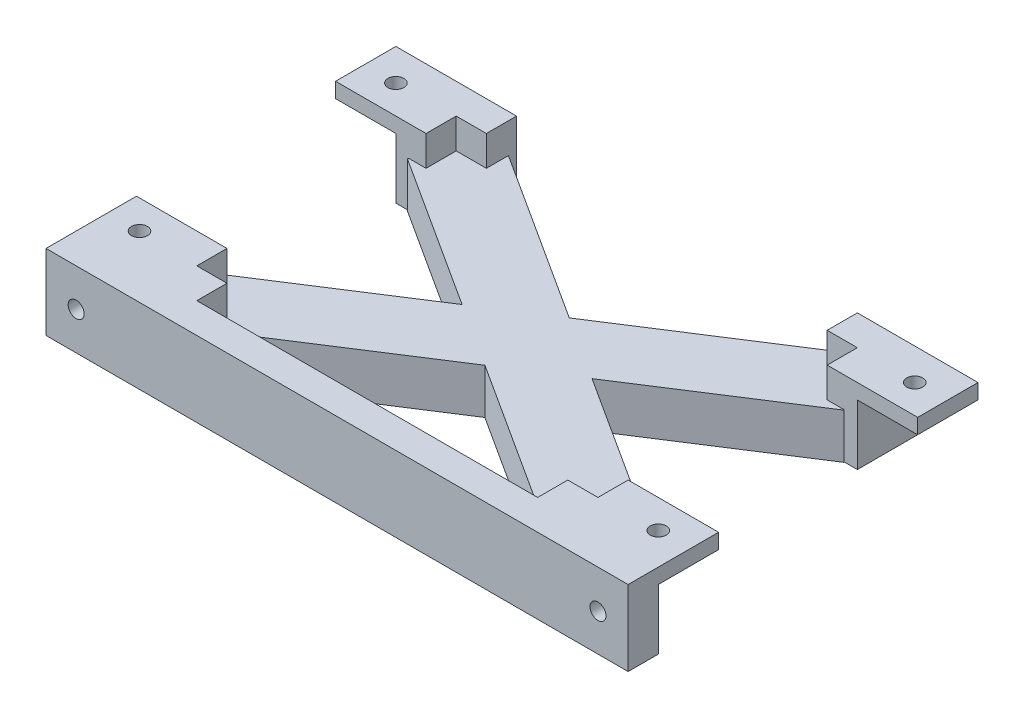
from build123d import *

# Parameters (mm, degrees)
BOSS_EXTRUDE1_DEPTH        = 10
BOSS_EXTRUDE1_2_DEPTH      = 10
BOSS_EXTRUDE1_3_DEPTH      = 10
BOSS_EXTRUDE1_4_DEPTH      = 10
SKETCH1_3_W                = 20
SKETCH1_3_H                = 20
BOSS_EXTRUDE2_DEPTH        = 15
BOSS_EXTRUDE3_DEPTH        = 15
SKETCH3_W                  = 20
SKETCH3_H                  = 5
BOSS_EXTRUDE4_DEPTH        = 20
F_4_0_209_DIAMETER_HOLE1_D = 5.3086
SKETCH5_W                  = 193
SKETCH5_H                  = 25
BOSS_EXTRUDE5_DEPTH        = 10
F_4_0_209_DIAMETER_HOLE2_D = 5.3086


with BuildPart() as part:
    # Sketch1 → Boss-Extrude1 (new body)
    with BuildSketch(Plane(origin=(0, 0, 0), x_dir=(1, 0, 0), z_dir=(0, 1, 0))):
        Polygon((-56.5, 53), (-76.5, 53), (-76.5, 33), (-66.5, 33), (-66.5, 43), (-56.5, 43), align=None)
    extrude(amount=BOSS_EXTRUDE1_DEPTH)



with BuildPart() as body_2:
    # Sketch1 → Boss-Extrude1 2 (new body)
    with BuildSketch(Plane(origin=(0, 0, 0), x_dir=(1, 0, 0), z_dir=(0, 1, 0))):
        Polygon((-66.5, -43), (-66.5, -33), (-76.5, -33), (-76.5, -53), (-56.5, -53), (-56.5, -43), align=None)
    extrude(amount=BOSS_EXTRUDE1_2_DEPTH)


with BuildPart() as body_3:
    # Sketch1 → Boss-Extrude1 3 (new body)
    with BuildSketch(Plane(origin=(0, 0, 0), x_dir=(1, 0, 0), z_dir=(0, 1, 0))):
        Polygon((76.5, -53), (76.5, -33), (66.5, -33), (66.5, -43), (56.5, -43), (56.5, -53), align=None)
    extrude(amount=BOSS_EXTRUDE1_3_DEPTH)


with BuildPart() as body_4:
    # Sketch1 → Boss-Extrude1 4 (new body)
    with BuildSketch(Plane(origin=(0, 0, 0), x_dir=(1, 0, 0), z_dir=(0, 1, 0))):
        Polygon((76.5, 53), (56.5, 53), (56.5, 43), (66.5, 43), (66.5, 33), (76.5, 33), align=None)
    extrude(amount=BOSS_EXTRUDE1_4_DEPTH)


with BuildPart() as part_1:
    add(part.part)

    add(body_2.part)  # Boss-Extrude2 merges body 2

    add(body_3.part)  # Boss-Extrude2 merges body 3

    add(body_4.part)  # Boss-Extrude2 merges body 4
    # Sketch1<3> → Boss-Extrude2 (add)
    with BuildSketch(Plane(origin=(0, 0, 0), x_dir=(1, 0, 0), z_dir=(0, 1, 0))):
        with Locations((-66.5, 43)):
            Rectangle(SKETCH1_3_W, SKETCH1_3_H)
        with Locations((-66.5, -43)):
            Rectangle(SKETCH1_3_W, SKETCH1_3_H)
        with Locations((66.5, -43)):
            Rectangle(SKETCH1_3_W, SKETCH1_3_H)
        with Locations((66.5, 43)):
            Rectangle(SKETCH1_3_W, SKETCH1_3_H)
    extrude(amount=-BOSS_EXTRUDE2_DEPTH)

    # Sketch2 → Boss-Extrude3 (add)
    with BuildSketch(Plane(origin=(0, 0, 0), x_dir=(1, 0, 0), z_dir=(0, 1, 0))):
        Polygon((-59.664368284, 52.338863371), (-72.335631716, 32.661136629), (-21.409556012, -0.132169696), (-72.215306836, -32.84799409), (-59.784693164, -52.15200591), (-0.205251763, -13.786456523), (59.664368284, -52.338863371), (72.335631716, -32.661136629), (21.409556012, 0.132169696), (72.215306836, 32.84799409), (59.784693164, 52.15200591), (0.205251763, 13.786456523), align=None)
    extrude(amount=-BOSS_EXTRUDE3_DEPTH)

    # Sketch3 → Boss-Extrude4 (add)
    with BuildSketch(Plane.ZY.offset(76.5)):
        with Locations((-43, 7.5)):
            Rectangle(SKETCH3_W, SKETCH3_H)
        with Locations((43, 7.5)):
            Rectangle(SKETCH3_W, SKETCH3_H)
    boss_extrude4 = extrude(amount=BOSS_EXTRUDE4_DEPTH)

    # Mirror1: Boss-Extrude4 across plane
    add(boss_extrude4.mirror(Plane(origin=(0, 0, 0), x_dir=(0, 0, 1), z_dir=(1, 0, 0))))

    # #4 (0.209) Diameter Hole1 (through all)
    with Locations(Plane(origin=(-86, 10, -42.5), x_dir=(0, 0, 1), z_dir=(0, 1, 0))):
        with Locations((0, 0), (85, 0), (0, 172), (85, 172)):
            Hole(F_4_0_209_DIAMETER_HOLE1_D / 2)

    # Sketch5 → Boss-Extrude5 (add)
    with BuildSketch(Plane.XY.offset(53)):
        with Locations((0, -2.5)):
            Rectangle(SKETCH5_W, SKETCH5_H)
    extrude(amount=BOSS_EXTRUDE5_DEPTH)

    # #4 (0.209) Diameter Hole2 (through all)
    with Locations(Plane(origin=(0, 0, 53), x_dir=(-1, 0, 0), z_dir=(0, 0, -1))):
        with Locations((-86.5, -2.674811851), (86.5, -2.5)):
            Hole(F_4_0_209_DIAMETER_HOLE2_D / 2)


solid = part_1.part
